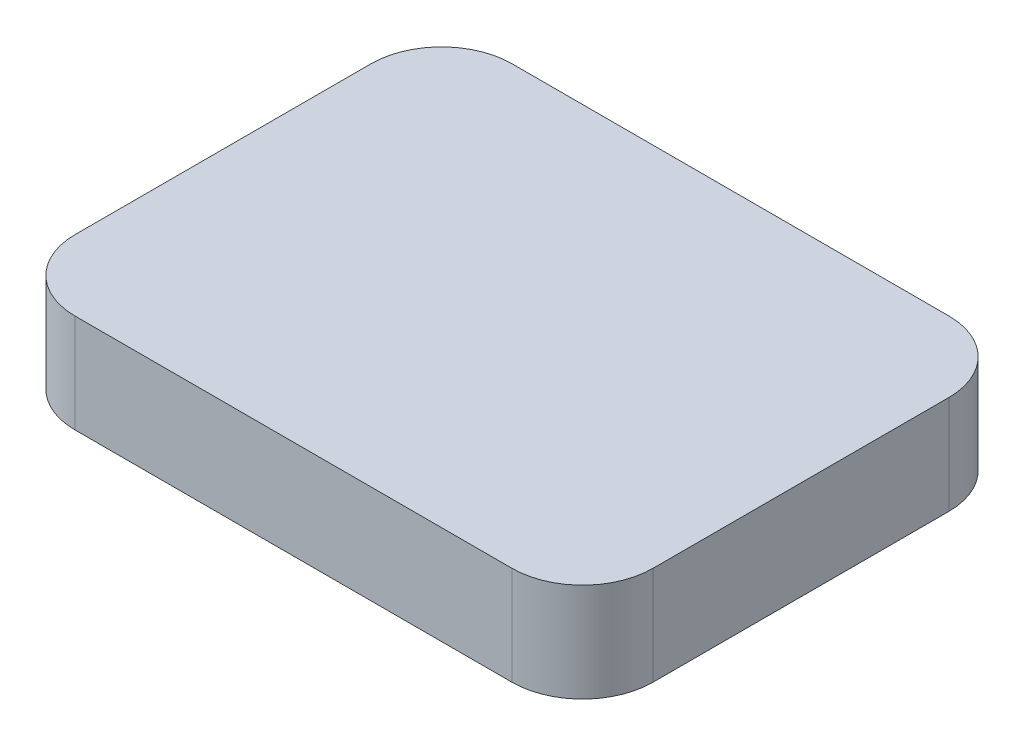
from build123d import *

# Parameters (mm, degrees)
BOSS_EXTRUDE1_DEPTH     = 7
CUT_EXTRUDE1_DEPTH      = 4
CUT_EXTRUDE1_DEPTH_BACK = 5
SKETCH2_W               = 31
SKETCH2_H               = 21


with BuildPart() as part:
    # Sketch1 → Boss-Extrude1 (new body)
    with BuildSketch(Plane(origin=(0, 0, 0), x_dir=(1, 0, 0), z_dir=(0, 1, 0))):
        with BuildLine():
            Line((-19.158798283, 16.042918455), (11.841201717, 16.042918455))
            ThreePointArc((11.841201717, 16.042918455), (15.376735623, 14.578452361), (16.841201717, 11.042918455))
            Line((16.841201717, 11.042918455), (16.841201717, -9.957081545))
            ThreePointArc((16.841201717, -9.957081545), (15.376735623, -13.492615451), (11.841201717, -14.957081545))
            Line((11.841201717, -14.957081545), (-19.158798283, -14.957081545))
            ThreePointArc((-19.158798283, -14.957081545), (-22.694332189, -13.492615451), (-24.158798283, -9.957081545))
            Line((-24.158798283, -9.957081545), (-24.158798283, 11.042918455))
            ThreePointArc((-24.158798283, 11.042918455), (-22.694332189, 14.578452361), (-19.158798283, 16.042918455))
        make_face()
    extrude(amount=BOSS_EXTRUDE1_DEPTH)

    # Sketch2 → Cut-Extrude1 (cut, two sides: drawn at the far end of the back side and taken through both)
    with BuildSketch(Plane.XZ.offset(-CUT_EXTRUDE1_DEPTH_BACK)):
        with Locations((-3.658798283, -0.542918455)):
            Rectangle(SKETCH2_W, SKETCH2_H)
    extrude(amount=CUT_EXTRUDE1_DEPTH + CUT_EXTRUDE1_DEPTH_BACK, mode=Mode.SUBTRACT)


solid = part.part
